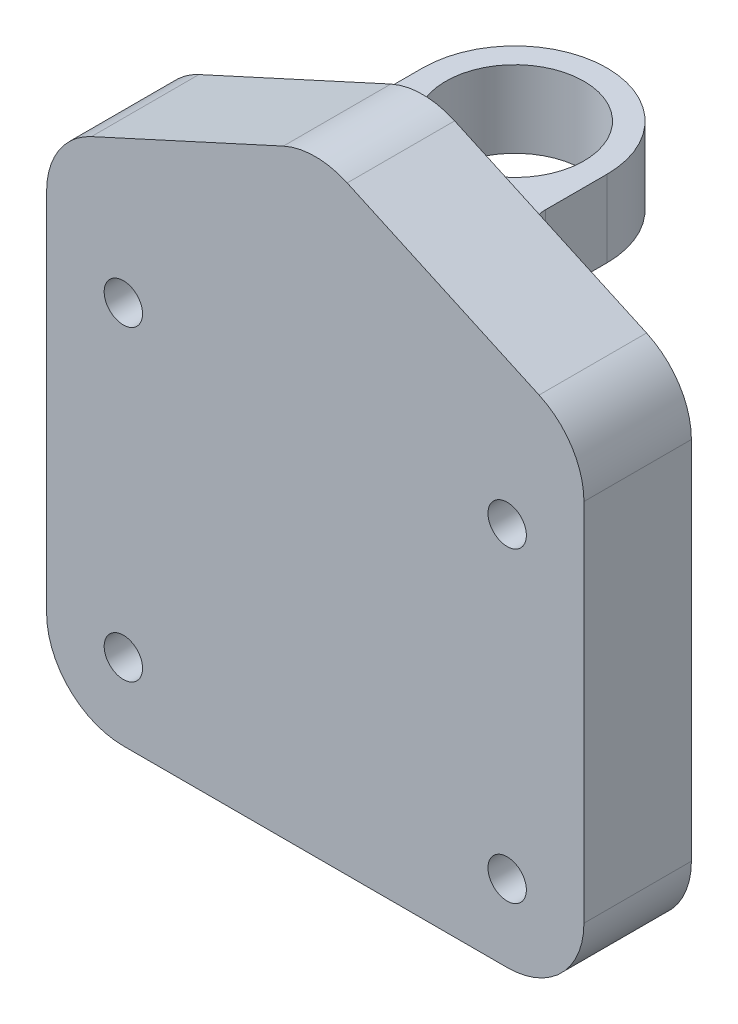
from build123d import *

# Parameters (mm, degrees)
SKETCH1_R           = 1.25
BOSS_EXTRUDE1_DEPTH = 7
SKETCH2_R           = 4.5
BOSS_EXTRUDE2_DEPTH = 5
SKETCH3_R           = 4.5
BOSS_EXTRUDE3_DEPTH = 5
FILLET1_R           = 2
FILLET2_R           = 5


with BuildPart() as part:
    # Sketch1 → Boss-Extrude1 (new body)
    with BuildSketch(Plane(origin=(0, -692.732289503, 224.634763615), x_dir=(1, 0, 0), z_dir=(0, 0, -1))):
        Polygon((17.5, -2.476720525), (17.5, -34.476720525), (0, -42.476720525), (-17.5, -34.476720525), (-17.5, -2.476720525), align=None)
        with Locations(Location((-12.5, -27.476720525, 0), (0, 0, 270))):
            Circle(SKETCH1_R, mode=Mode.SUBTRACT)
        with Locations(Location((12.5, -27.476720525, 0), (0, 0, 270))):
            Circle(SKETCH1_R, mode=Mode.SUBTRACT)
        with Locations(Location((12.5, -7.476720525, 0), (0, 0, 270))):
            Circle(SKETCH1_R, mode=Mode.SUBTRACT)
        with Locations(Location((-12.5, -7.476720525, 0), (0, 0, 270))):
            Circle(SKETCH1_R, mode=Mode.SUBTRACT)
    extrude(amount=BOSS_EXTRUDE1_DEPTH)

    # Sketch2 → Boss-Extrude2 (add)
    with BuildSketch(Plane.XZ.offset(655.255568978)):
        with BuildLine():
            Line((6, 217.634763615), (-6, 217.634763615))
            Line((-6, 217.634763615), (-6, 211.634763615))
            ThreePointArc((-6, 211.634763615), (0, 205.634763615), (6, 211.634763615))
            Line((6, 211.634763615), (6, 217.634763615))
        make_face()
        with Locations(Location((0, 211.634763615, 0), (0, 0, 270))):
            Circle(SKETCH2_R, mode=Mode.SUBTRACT)
    extrude(amount=BOSS_EXTRUDE2_DEPTH)

    # Sketch3 → Boss-Extrude3 (add)
    with BuildSketch(Plane.XZ.offset(685.255568978)):
        with BuildLine():
            Line((6, 217.634763615), (-6, 217.634763615))
            Line((-6, 217.634763615), (-6, 211.634763615))
            ThreePointArc((-6, 211.634763615), (0, 205.634763615), (6, 211.634763615))
            Line((6, 211.634763615), (6, 217.634763615))
        make_face()
        with Locations(Location((0, 211.634763615, 0), (0, 0, 270))):
            Circle(SKETCH3_R, mode=Mode.SUBTRACT)
    extrude(amount=BOSS_EXTRUDE3_DEPTH)

    # Fillet1
    fillet1_edges = [part.edges().sort_by_distance(p)[0] for p in [
        (6, -657.755568978, 217.634763615),
        (-6, -657.755568978, 217.634763615),
        (6, -687.755568978, 217.634763615),
        (-6, -687.755568978, 217.634763615),
    ]]
    fillet(fillet1_edges, radius=FILLET1_R)

    # Fillet2
    fillet2_edges = [part.edges().sort_by_distance(p)[0] for p in [
        (17.5, -690.255568978, 221.134763615),
        (17.5, -658.255568978, 221.134763615),
        (0, -650.255568978, 221.134763615),
        (-17.5, -658.255568978, 221.134763615),
        (-17.5, -690.255568978, 221.134763615),
    ]]
    fillet(fillet2_edges, radius=FILLET2_R)


solid = part.part
